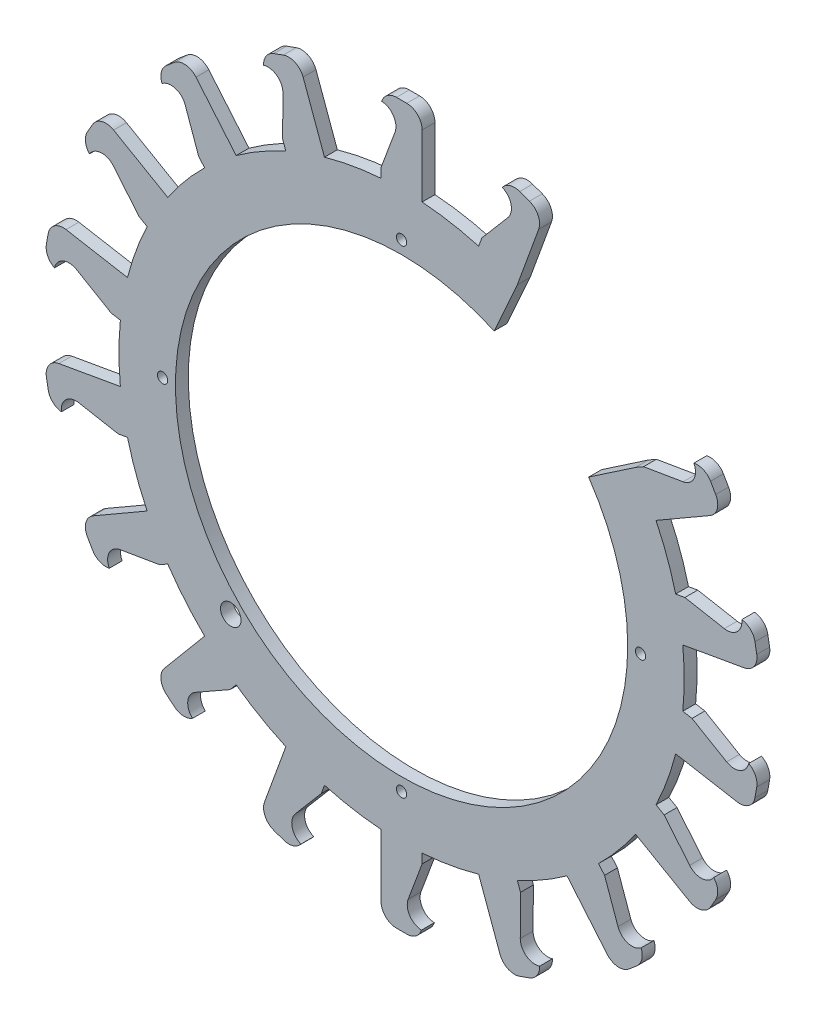
from build123d import *

# Parameters (mm, degrees)
SKETCH1_R           = 69.85
SKETCH1_R_2         = 55.88
BOSS_EXTRUDE1_DEPTH = 3.175
BOSS_EXTRUDE2_DEPTH = 3.175
FILLET4_R           = 3.81
CUT_EXTRUDE1_DEPTH  = 134.459474302
SKETCH4_R           = 2.54
SKETCH4_R_2         = 1.27
CUT_EXTRUDE2_DEPTH  = 134.459474302


with BuildPart() as part:
    # Sketch1 → Boss-Extrude1 (new body)
    with BuildSketch(Plane.XY):
        with Locations((-8.548720341, -3.365444156)):
            Circle(SKETCH1_R)
        with Locations((-8.548720341, -3.365444156)):
            Circle(SKETCH1_R_2, mode=Mode.SUBTRACT)
    extrude(amount=BOSS_EXTRUDE1_DEPTH)

    # Sketch2 → Boss-Extrude2 (add)
    with BuildSketch(Plane(origin=(0, 0, 3.175), x_dir=(-1, 0, 0), z_dir=(0, 0, -1))):
        Polygon((8.548720341, 62.674555844), (13.628720341, 62.674555844), (13.628720341, 85.534555844), (3.468720341, 85.534555844), (3.468720341, 62.674555844), align=None)
        Polygon((34.180672569, 81.91069216), (43.727949596, 78.435767503), (35.90936912, 56.954394192), (31.135730606, 58.69185652), (26.362092093, 60.429318849), align=None)
        Polygon((61.801033071, 68.001267894), (69.584044613, 61.47054578), (54.889919856, 43.95876981), (50.998414085, 47.224130867), (47.106908314, 50.489491924), align=None)
        Polygon((82.998378738, 45.483964895), (88.078378738, 36.685146792), (68.281038007, 25.255146792), (65.741038007, 29.654555844), (63.201038007, 34.053964895), align=None)
        Polygon((95.215996841, 17.074702224), (96.980262327, 7.069055453), (74.467557093, 3.099458112), (73.58542435, 8.102281497), (72.703291608, 13.105104882), align=None)
        Polygon((96.980262327, -13.799943766), (95.215996841, -23.805590536), (72.703291608, -19.835993195), (73.58542435, -14.833169809), (74.467557093, -9.830346424), align=None)
        Polygon((88.078378738, -43.416035105), (82.998378738, -52.214853208), (63.201038007, -40.784853208), (65.741038007, -36.385444156), (68.281038007, -31.986035105), align=None)
        Polygon((69.584044613, -68.201434092), (61.801033071, -74.732156207), (47.106908314, -57.220380237), (50.998414085, -53.95501918), (54.889919856, -50.689658123), align=None)
        Polygon((43.727949596, -85.166655816), (34.180672569, -88.641580472), (26.362092093, -67.160207161), (31.135730606, -65.422744833), (35.90936912, -63.685282505), align=None)
        Polygon((13.628720341, -92.265444156), (3.468720341, -92.265444156), (3.468720341, -69.405444156), (8.548720341, -69.405444156), (13.628720341, -69.405444156), align=None)
        Polygon((-17.083231887, -88.641580472), (-26.630508914, -85.166655816), (-18.811928438, -63.685282505), (-14.038289924, -65.422744833), (-9.26465141, -67.160207161), align=None)
        Polygon((-44.703592389, -74.732156207), (-52.486603931, -68.201434092), (-37.792479174, -50.689658123), (-33.900973402, -53.95501918), (-30.009467631, -57.220380237), align=None)
        Polygon((-65.900938055, -52.214853208), (-70.980938055, -43.416035105), (-51.183597325, -31.986035105), (-48.643597325, -36.385444156), (-46.103597325, -40.784853208), align=None)
        Polygon((-78.118556159, -23.805590536), (-79.882821644, -13.799943766), (-57.37011641, -9.830346424), (-56.487983668, -14.833169809), (-55.605850925, -19.835993195), align=None)
        Polygon((-79.882821644, 7.069055453), (-78.118556159, 17.074702224), (-55.605850925, 13.105104882), (-56.487983668, 8.102281497), (-57.37011641, 3.099458112), align=None)
        Polygon((-70.980938055, 36.685146792), (-65.900938055, 45.483964895), (-46.103597325, 34.053964895), (-48.643597325, 29.654555844), (-51.183597325, 25.255146792), align=None)
        Polygon((-52.486603931, 61.47054578), (-44.703592389, 68.001267894), (-30.009467631, 50.489491924), (-33.900973402, 47.224130867), (-37.792479174, 43.95876981), align=None)
        Polygon((-26.630508914, 78.435767503), (-17.083231887, 81.91069216), (-9.26465141, 60.429318849), (-14.038289924, 58.69185652), (-18.811928438, 56.954394192), align=None)
    extrude(amount=BOSS_EXTRUDE2_DEPTH)

    # Fillet4
    fillet4_edges = [part.edges().sort_by_distance(p)[0] for p in [
        (-82.998378738, 45.483964895, 1.5875),
        (-88.078378738, 36.685146792, 1.5875),
        (-95.215996841, 17.074702224, 1.5875),
        (-96.980262327, 7.069055453, 1.5875),
        (-96.980262327, -13.799943766, 1.5875),
        (-95.215996841, -23.805590536, 1.5875),
        (-88.078378738, -43.416035105, 1.5875),
        (-82.998378738, -52.214853208, 1.5875),
        (-69.584044613, -68.201434092, 1.5875),
        (-61.801033071, -74.732156207, 1.5875),
        (-43.727949596, -85.166655816, 1.5875),
        (-34.180672569, -88.641580472, 1.5875),
        (-13.628720341, -92.265444156, 1.5875),
        (-3.468720341, -92.265444156, 1.5875),
        (17.083231887, -88.641580472, 1.5875),
        (26.630508914, -85.166655816, 1.5875),
        (-3.468720341, 85.534555844, 1.5875),
        (-13.628720341, 85.534555844, 1.5875),
        (44.703592389, -74.732156207, 1.5875),
        (52.486603931, -68.201434092, 1.5875),
        (65.900938055, -52.214853208, 1.5875),
        (70.980938055, -43.416035105, 1.5875),
        (78.118556159, -23.805590536, 1.5875),
        (79.882821644, -13.799943766, 1.5875),
        (79.882821644, 7.069055453, 1.5875),
        (78.118556159, 17.074702224, 1.5875),
        (70.980938055, 36.685146792, 1.5875),
        (65.900938055, 45.483964895, 1.5875),
        (52.486603931, 61.47054578, 1.5875),
        (44.703592389, 68.001267894, 1.5875),
        (26.630508914, 78.435767503, 1.5875),
        (17.083231887, 81.91069216, 1.5875),
        (-34.180672569, 81.91069216, 1.5875),
        (-43.727949596, 78.435767503, 1.5875),
        (-61.801033071, 68.001267894, 1.5875),
        (-69.584044613, 61.47054578, 1.5875),
    ]]
    fillet(fillet4_edges, radius=FILLET4_R)

    # Sketch3 → Cut-Extrude1 (cut, through all)
    with BuildSketch(Plane(origin=(0, 0, 0), x_dir=(-1, 0, 0), z_dir=(0, 0, -1))):
        with BuildLine():
            Line((13.628720341, 68.616049563), (10.176595979, 77.901073709))
            ThreePointArc((10.176595979, 77.901073709), (12.345238207, 82.636680206), (17.080844703, 80.468037978))
            Line((17.080844703, 80.468037978), (20.532969065, 71.183013832))
            ThreePointArc((20.532969065, 71.183013832), (18.364326838, 66.447407336), (13.628720341, 68.616049563))
        make_face()
        with BuildLine():
            Line((37.941479654, 62.537571997), (37.873209154, 72.44333674))
            ThreePointArc((37.873209154, 72.44333674), (41.530739065, 76.151631894), (45.239034219, 72.494101983))
            Line((45.239034219, 72.494101983), (45.307304719, 62.58833724))
            ThreePointArc((45.307304719, 62.58833724), (41.649774808, 58.880042086), (37.941479654, 62.537571997))
        make_face()
        with BuildLine():
            Line((58.709038402, 48.510218058), (62.032856194, 57.841941976))
            ThreePointArc((62.032856194, 57.841941976), (66.738121702, 60.075650664), (68.97183039, 55.370385156))
            Line((68.97183039, 55.370385156), (65.648012597, 46.038661238))
            ThreePointArc((65.648012597, 46.038661238), (60.94274709, 43.80495255), (58.709038402, 48.510218058))
        make_face()
        with BuildLine():
            Line((73.426522505, 28.225893652), (79.741527109, 35.85803312))
            ThreePointArc((79.741527109, 35.85803312), (84.927003751, 36.347737107), (85.416707738, 31.162260465))
            Line((85.416707738, 31.162260465), (79.101703134, 23.530120998))
            ThreePointArc((79.101703134, 23.530120998), (73.916226492, 23.04041701), (73.426522505, 28.225893652))
        make_face()
        with BuildLine():
            Line((80.318786172, 4.131187669), (88.863294833, 9.143194027))
            ThreePointArc((88.863294833, 9.143194027), (93.903537597, 7.829827786), (92.590171356, 2.789585023))
            Line((92.590171356, 2.789585023), (84.045662695, -2.222421336))
            ThreePointArc((84.045662695, -2.222421336), (79.005419931, -0.909055095), (80.318786172, 4.131187669))
        make_face()
        with BuildLine():
            Line((78.554520687, -20.867722752), (88.297939557, -19.080371438))
            ThreePointArc((88.297939557, -19.080371438), (92.58502078, -22.038396556), (89.626995662, -26.325477778))
            Line((89.626995662, -26.325477778), (79.883576792, -28.112829091))
            ThreePointArc((79.883576792, -28.112829091), (75.59649557, -25.154803974), (78.554520687, -20.867722752))
        make_face()
        with BuildLine():
            Line((68.346522505, -43.755600067), (78.113651471, -45.408484746))
            ThreePointArc((78.113651471, -45.408484746), (81.130485885, -49.654387255), (76.884583377, -52.671221669))
            Line((76.884583377, -52.671221669), (67.11745441, -51.018336991))
            ThreePointArc((67.11745441, -51.018336991), (64.100619996, -46.772434482), (68.346522505, -43.755600067))
        make_face()
        with BuildLine():
            Line((50.92602686, -61.771828485), (59.538806021, -66.665586869))
            ThreePointArc((59.538806021, -66.665586869), (60.921518874, -71.687248264), (55.899857479, -73.069961117))
            Line((55.899857479, -73.069961117), (47.287078318, -68.176202733))
            ThreePointArc((47.287078318, -68.176202733), (45.904365465, -63.154541338), (50.92602686, -61.771828485))
        make_face()
        with BuildLine():
            Line((28.394202626, -72.743384966), (34.813803704, -80.28775757))
            ThreePointArc((34.813803704, -80.28775757), (34.395619419, -85.479491376), (29.203885614, -85.06130709))
            Line((29.203885614, -85.06130709), (22.784284536, -77.516934485))
            ThreePointArc((22.784284536, -77.516934485), (23.202468821, -72.32520068), (28.394202626, -72.743384966))
        make_face()
        with BuildLine():
            Line((3.468720341, -75.346937876), (6.920844703, -84.631962022))
            ThreePointArc((6.920844703, -84.631962022), (4.752202476, -89.367568518), (0.016595979, -87.198926291))
            Line((0.016595979, -87.198926291), (-3.435528383, -77.913902145))
            ThreePointArc((-3.435528383, -77.913902145), (-1.266886155, -73.178295648), (3.468720341, -75.346937876))
        make_face()
        with BuildLine():
            Line((-20.844038971, -69.26846031), (-20.775768471, -79.174225052))
            ThreePointArc((-20.775768471, -79.174225052), (-24.433298382, -82.882520207), (-28.141593536, -79.224990296))
            Line((-28.141593536, -79.224990296), (-28.209864036, -69.319225553))
            ThreePointArc((-28.209864036, -69.319225553), (-24.552334125, -65.610930399), (-20.844038971, -69.26846031))
        make_face()
        with BuildLine():
            Line((-41.611597719, -55.24110637), (-44.935415512, -64.572830288))
            ThreePointArc((-44.935415512, -64.572830288), (-49.640681019, -66.806538976), (-51.874389707, -62.101273469))
            Line((-51.874389707, -62.101273469), (-48.550571915, -52.76954955))
            ThreePointArc((-48.550571915, -52.76954955), (-43.845306407, -50.535840863), (-41.611597719, -55.24110637))
        make_face()
        with BuildLine():
            Line((-56.329081822, -34.956781965), (-62.644086426, -42.588921432))
            ThreePointArc((-62.644086426, -42.588921432), (-67.829563068, -43.07862542), (-68.319267056, -37.893148778))
            Line((-68.319267056, -37.893148778), (-62.004262452, -30.26100931))
            ThreePointArc((-62.004262452, -30.26100931), (-56.81878581, -29.771305323), (-56.329081822, -34.956781965))
        make_face()
        with BuildLine():
            Line((-63.22134549, -10.862075981), (-71.765854151, -15.87408234))
            ThreePointArc((-71.765854151, -15.87408234), (-76.806096915, -14.560716099), (-75.492730674, -9.520473335))
            Line((-75.492730674, -9.520473335), (-66.948222013, -4.508466977))
            ThreePointArc((-66.948222013, -4.508466977), (-61.907979249, -5.821833217), (-63.22134549, -10.862075981))
        make_face()
        with BuildLine():
            Line((-61.457080005, 14.136834439), (-71.200498875, 12.349483126))
            ThreePointArc((-71.200498875, 12.349483126), (-75.487580097, 15.307508243), (-72.52955498, 19.594589465))
            Line((-72.52955498, 19.594589465), (-62.78613611, 21.381940779))
            ThreePointArc((-62.78613611, 21.381940779), (-58.499054887, 18.423915661), (-61.457080005, 14.136834439))
        make_face()
        with BuildLine():
            Line((-51.249081822, 37.024711755), (-61.016210788, 38.677596433))
            ThreePointArc((-61.016210788, 38.677596433), (-64.033045203, 42.923498942), (-59.787142694, 45.940333357))
            Line((-59.787142694, 45.940333357), (-50.020013728, 44.287448678))
            ThreePointArc((-50.020013728, 44.287448678), (-47.003179313, 40.041546169), (-51.249081822, 37.024711755))
        make_face()
        with BuildLine():
            Line((-33.828586177, 55.040940172), (-42.441365338, 59.934698556))
            ThreePointArc((-42.441365338, 59.934698556), (-43.824078191, 64.956359951), (-38.802416796, 66.339072804))
            Line((-38.802416796, 66.339072804), (-30.189637635, 61.44531442))
            ThreePointArc((-30.189637635, 61.44531442), (-28.806924782, 56.423653025), (-33.828586177, 55.040940172))
        make_face()
        with BuildLine():
            Line((-11.296761944, 66.012496653), (-17.716363022, 73.556869258))
            ThreePointArc((-17.716363022, 73.556869258), (-17.298178737, 78.748603063), (-12.106444931, 78.330418777))
            Line((-12.106444931, 78.330418777), (-5.686843853, 70.786046173))
            ThreePointArc((-5.686843853, 70.786046173), (-6.105028139, 65.594312368), (-11.296761944, 66.012496653))
        make_face()
    extrude(amount=-CUT_EXTRUDE1_DEPTH, mode=Mode.SUBTRACT)

    # Sketch4 → Cut-Extrude2 (cut, through all)
    with BuildSketch(Plane(origin=(0, 0, 0), x_dir=(-1, 0, 0), z_dir=(0, 0, -1))):
        Polygon((-56.706534966, 61.889811151), (-49.242963499, 35.866478801), (-37.684626731, 28.020094209), (-14.331664707, 47.61555603), (-20.051760969, 60.360806077), (-31.43478322, 76.89604601), align=None)
        with Locations((50.75592411, -45.572647925)):
            Circle(SKETCH4_R)
        with Locations((-50.506279659, -3.365444156)):
            Circle(SKETCH4_R_2)
        with Locations((8.548720341, 55.689555844)):
            Circle(SKETCH4_R_2)
        with Locations((8.548720341, -62.420444156)):
            Circle(SKETCH4_R_2)
        with Locations((67.603720341, -3.365444156)):
            Circle(SKETCH4_R_2)
    extrude(amount=-CUT_EXTRUDE2_DEPTH, mode=Mode.SUBTRACT)


solid = part.part
